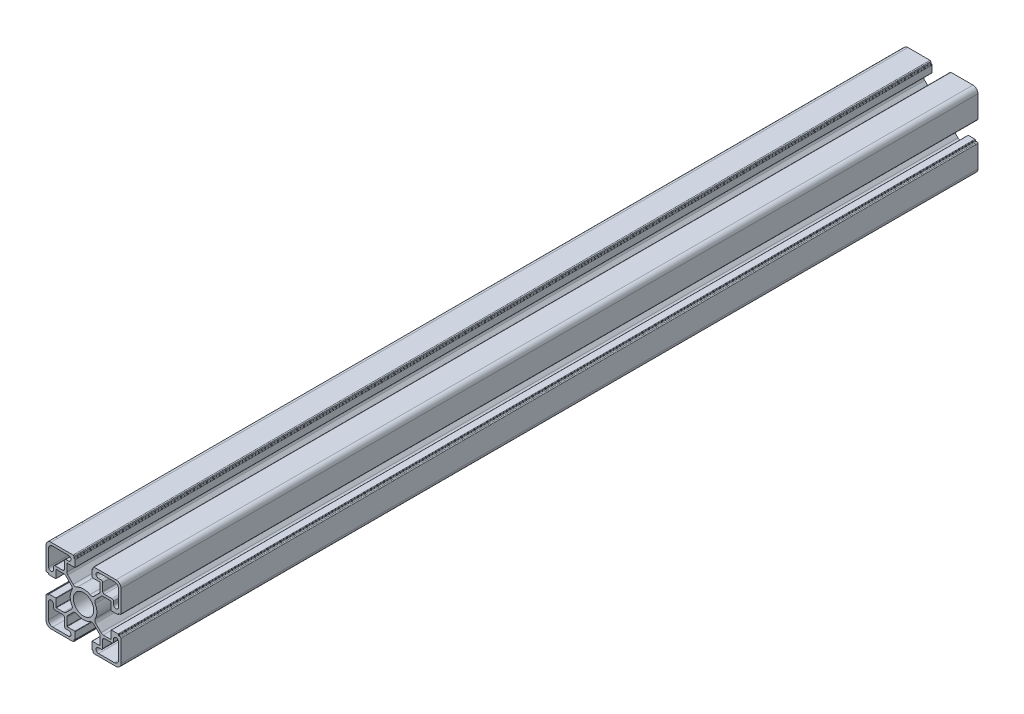
from build123d import *

# Parameters (mm, degrees)
BOSS_EXTRUDE1_DEPTH = 513.777971599
SCALE1_SCALE        = 0.5644444


with BuildPart() as part:
    # Sketch1 → Boss-Extrude1 (new body)
    with BuildSketch(Plane.XY):
        with BuildLine():
            Line((-22.5, 19.5), (-22.5, 6.3))
            ThreePointArc((-22.5, 6.3), (-22.353553391, 5.946446609), (-22, 5.8))
            Line((-22, 5.8), (-21.3, 5.8))
            ThreePointArc((-21.3, 5.8), (-21.087867966, 5.712132034), (-21, 5.5))
            Line((-21, 5.5), (-21, 5.3))
            ThreePointArc((-21, 5.3), (-20.912132034, 5.087867966), (-20.7, 5))
            Line((-20.7, 5), (-16.7, 5))
            ThreePointArc((-16.7, 5), (-16.558578644, 5.058578644), (-16.5, 5.2))
            Line((-16.5, 5.2), (-16.5, 9.8))
            ThreePointArc((-16.5, 9.8), (-16.441421356, 9.941421356), (-16.3, 10))
            Line((-16.3, 10), (-11.864234483, 10))
            ThreePointArc((-11.864234483, 10), (-11.121828624, 9.852326293), (-10.492447327, 9.431787156))
            Line((-10.492447327, 9.431787156), (-7.296699127, 6.236038955))
            ThreePointArc((-7.296699127, 6.236038955), (-6.746669172, 5.129240469), (-6.976648919, 3.914890784))
            ThreePointArc((-6.976648919, 3.914890784), (-7.739935121, 2.023216331), (-8, 0))
            ThreePointArc((-8, 0), (-7.739935121, -2.023216331), (-6.976648919, -3.914890784))
            ThreePointArc((-6.976648919, -3.914890784), (-6.746669172, -5.129240469), (-7.296699127, -6.236038955))
            Line((-7.296699127, -6.236038955), (-10.492447327, -9.431787156))
            ThreePointArc((-10.492447327, -9.431787156), (-11.121828624, -9.852326293), (-11.864234483, -10))
            Line((-11.864234483, -10), (-16.3, -10))
            ThreePointArc((-16.3, -10), (-16.441421356, -9.941421356), (-16.5, -9.8))
            Line((-16.5, -9.8), (-16.5, -5.2))
            ThreePointArc((-16.5, -5.2), (-16.558578644, -5.058578644), (-16.7, -5))
            Line((-16.7, -5), (-20.7, -5))
            ThreePointArc((-20.7, -5), (-20.912132034, -5.087867966), (-21, -5.3))
            Line((-21, -5.3), (-21, -5.5))
            ThreePointArc((-21, -5.5), (-21.087867966, -5.712132034), (-21.3, -5.8))
            Line((-21.3, -5.8), (-22, -5.8))
            ThreePointArc((-22, -5.8), (-22.353553391, -5.946446609), (-22.5, -6.3))
            Line((-22.5, -6.3), (-22.5, -19.5))
            ThreePointArc((-22.5, -19.5), (-21.621320344, -21.621320344), (-19.5, -22.5))
            Line((-19.5, -22.5), (-6.3, -22.5))
            ThreePointArc((-6.3, -22.5), (-5.946446609, -22.353553391), (-5.8, -22))
            Line((-5.8, -22), (-5.8, -21.3))
            ThreePointArc((-5.8, -21.3), (-5.712132034, -21.087867966), (-5.5, -21))
            Line((-5.5, -21), (-5.3, -21))
            ThreePointArc((-5.3, -21), (-5.087867966, -20.912132034), (-5, -20.7))
            Line((-5, -20.7), (-5, -16.7))
            ThreePointArc((-5, -16.7), (-5.058578644, -16.558578644), (-5.2, -16.5))
            Line((-5.2, -16.5), (-9.8, -16.5))
            ThreePointArc((-9.8, -16.5), (-9.941421356, -16.441421356), (-10, -16.3))
            Line((-10, -16.3), (-10, -11.864234483))
            ThreePointArc((-10, -11.864234483), (-9.852326293, -11.121828624), (-9.431787156, -10.492447327))
            Line((-9.431787156, -10.492447327), (-6.236038955, -7.296699127))
            ThreePointArc((-6.236038955, -7.296699127), (-5.129240469, -6.746669172), (-3.914890784, -6.976648919))
            ThreePointArc((-3.914890784, -6.976648919), (-2.023216331, -7.739935121), (0, -8))
            ThreePointArc((0, -8), (2.023216331, -7.739935121), (3.914890784, -6.976648919))
            ThreePointArc((3.914890784, -6.976648919), (5.129240469, -6.746669172), (6.236038955, -7.296699127))
            Line((6.236038955, -7.296699127), (9.431787156, -10.492447327))
            ThreePointArc((9.431787156, -10.492447327), (9.852326293, -11.121828624), (10, -11.864234483))
            Line((10, -11.864234483), (10, -16.3))
            ThreePointArc((10, -16.3), (9.941421356, -16.441421356), (9.8, -16.5))
            Line((9.8, -16.5), (5.2, -16.5))
            ThreePointArc((5.2, -16.5), (5.058578644, -16.558578644), (5, -16.7))
            Line((5, -16.7), (5, -20.7))
            ThreePointArc((5, -20.7), (5.087867966, -20.912132034), (5.3, -21))
            Line((5.3, -21), (5.5, -21))
            ThreePointArc((5.5, -21), (5.712132034, -21.087867966), (5.8, -21.3))
            Line((5.8, -21.3), (5.8, -22))
            ThreePointArc((5.8, -22), (5.946446609, -22.353553391), (6.3, -22.5))
            Line((6.3, -22.5), (19.5, -22.5))
            ThreePointArc((19.5, -22.5), (21.621320344, -21.621320344), (22.5, -19.5))
            Line((22.5, -19.5), (22.5, -6.3))
            ThreePointArc((22.5, -6.3), (22.353553391, -5.946446609), (22, -5.8))
            Line((22, -5.8), (21.3, -5.8))
            ThreePointArc((21.3, -5.8), (21.087867966, -5.712132034), (21, -5.5))
            Line((21, -5.5), (21, -5.3))
            ThreePointArc((21, -5.3), (20.912132034, -5.087867966), (20.7, -5))
            Line((20.7, -5), (16.7, -5))
            ThreePointArc((16.7, -5), (16.558578644, -5.058578644), (16.5, -5.2))
            Line((16.5, -5.2), (16.5, -9.8))
            ThreePointArc((16.5, -9.8), (16.441421356, -9.941421356), (16.3, -10))
            Line((16.3, -10), (11.864234483, -10))
            ThreePointArc((11.864234483, -10), (11.121828624, -9.852326293), (10.492447327, -9.431787156))
            Line((10.492447327, -9.431787156), (7.296699127, -6.236038955))
            ThreePointArc((7.296699127, -6.236038955), (6.746669172, -5.129240469), (6.976648919, -3.914890784))
            ThreePointArc((6.976648919, -3.914890784), (7.739935121, -2.023216331), (8, 0))
            ThreePointArc((8, 0), (7.739935121, 2.023216331), (6.976648919, 3.914890784))
            ThreePointArc((6.976648919, 3.914890784), (6.746669172, 5.129240469), (7.296699127, 6.236038955))
            Line((7.296699127, 6.236038955), (10.492447327, 9.431787156))
            ThreePointArc((10.492447327, 9.431787156), (11.121828624, 9.852326293), (11.864234483, 10))
            Line((11.864234483, 10), (16.3, 10))
            ThreePointArc((16.3, 10), (16.441421356, 9.941421356), (16.5, 9.8))
            Line((16.5, 9.8), (16.5, 5.2))
            ThreePointArc((16.5, 5.2), (16.558578644, 5.058578644), (16.7, 5))
            Line((16.7, 5), (20.7, 5))
            ThreePointArc((20.7, 5), (20.912132034, 5.087867966), (21, 5.3))
            Line((21, 5.3), (21, 5.5))
            ThreePointArc((21, 5.5), (21.087867966, 5.712132034), (21.3, 5.8))
            Line((21.3, 5.8), (22, 5.8))
            ThreePointArc((22, 5.8), (22.353553391, 5.946446609), (22.5, 6.3))
            Line((22.5, 6.3), (22.5, 19.5))
            ThreePointArc((22.5, 19.5), (21.621320344, 21.621320344), (19.5, 22.5))
            Line((19.5, 22.5), (6.3, 22.5))
            ThreePointArc((6.3, 22.5), (5.946446609, 22.353553391), (5.8, 22))
            Line((5.8, 22), (5.8, 21.3))
            ThreePointArc((5.8, 21.3), (5.712132034, 21.087867966), (5.5, 21))
            Line((5.5, 21), (5.3, 21))
            ThreePointArc((5.3, 21), (5.087867966, 20.912132034), (5, 20.7))
            Line((5, 20.7), (5, 16.7))
            ThreePointArc((5, 16.7), (5.058578644, 16.558578644), (5.2, 16.5))
            Line((5.2, 16.5), (9.8, 16.5))
            ThreePointArc((9.8, 16.5), (9.941421356, 16.441421356), (10, 16.3))
            Line((10, 16.3), (10, 11.864234483))
            ThreePointArc((10, 11.864234483), (9.852326293, 11.121828624), (9.431787156, 10.492447327))
            Line((9.431787156, 10.492447327), (6.236038955, 7.296699127))
            ThreePointArc((6.236038955, 7.296699127), (5.129240469, 6.746669172), (3.914890784, 6.976648919))
            ThreePointArc((3.914890784, 6.976648919), (2.023216331, 7.739935121), (0, 8))
            ThreePointArc((0, 8), (-2.023216331, 7.739935121), (-3.914890784, 6.976648919))
            ThreePointArc((-3.914890784, 6.976648919), (-5.129240469, 6.746669172), (-6.236038955, 7.296699127))
            Line((-6.236038955, 7.296699127), (-9.431787156, 10.492447327))
            ThreePointArc((-9.431787156, 10.492447327), (-9.852326293, 11.121828624), (-10, 11.864234483))
            Line((-10, 11.864234483), (-10, 16.3))
            ThreePointArc((-10, 16.3), (-9.941421356, 16.441421356), (-9.8, 16.5))
            Line((-9.8, 16.5), (-5.2, 16.5))
            ThreePointArc((-5.2, 16.5), (-5.058578644, 16.558578644), (-5, 16.7))
            Line((-5, 16.7), (-5, 20.7))
            ThreePointArc((-5, 20.7), (-5.087867966, 20.912132034), (-5.3, 21))
            Line((-5.3, 21), (-5.5, 21))
            ThreePointArc((-5.5, 21), (-5.712132034, 21.087867966), (-5.8, 21.3))
            Line((-5.8, 21.3), (-5.8, 22))
            ThreePointArc((-5.8, 22), (-5.946446609, 22.353553391), (-6.3, 22.5))
            Line((-6.3, 22.5), (-19.5, 22.5))
            ThreePointArc((-19.5, 22.5), (-21.621320344, 21.621320344), (-22.5, 19.5))
        make_face()
        with BuildLine():
            Line((-21, 18.5), (-21, 9))
            ThreePointArc((-21, 9), (-19.5, 7.5), (-18, 9))
            Line((-18, 9), (-18, 10.5))
            ThreePointArc((-18, 10.5), (-17.707106781, 11.207106781), (-17, 11.5))
            Line((-17, 11.5), (-12.5, 11.5))
            ThreePointArc((-12.5, 11.5), (-11.792893219, 11.792893219), (-11.5, 12.5))
            Line((-11.5, 12.5), (-11.5, 17))
            ThreePointArc((-11.5, 17), (-11.207106781, 17.707106781), (-10.5, 18))
            Line((-10.5, 18), (-9, 18))
            ThreePointArc((-9, 18), (-7.5, 19.5), (-9, 21))
            Line((-9, 21), (-18.5, 21))
            ThreePointArc((-18.5, 21), (-20.267766953, 20.267766953), (-21, 18.5))
        make_face(mode=Mode.SUBTRACT)
        with BuildLine():
            Line((18.5, 21), (9, 21))
            ThreePointArc((9, 21), (7.5, 19.5), (9, 18))
            Line((9, 18), (10.5, 18))
            ThreePointArc((10.5, 18), (11.207106781, 17.707106781), (11.5, 17))
            Line((11.5, 17), (11.5, 12.5))
            ThreePointArc((11.5, 12.5), (11.792893219, 11.792893219), (12.5, 11.5))
            Line((12.5, 11.5), (17, 11.5))
            ThreePointArc((17, 11.5), (17.707106781, 11.207106781), (18, 10.5))
            Line((18, 10.5), (18, 9))
            ThreePointArc((18, 9), (19.5, 7.5), (21, 9))
            Line((21, 9), (21, 18.5))
            ThreePointArc((21, 18.5), (20.267766953, 20.267766953), (18.5, 21))
        make_face(mode=Mode.SUBTRACT)
        with BuildLine():
            Line((21, -18.5), (21, -9))
            ThreePointArc((21, -9), (19.5, -7.5), (18, -9))
            Line((18, -9), (18, -10.5))
            ThreePointArc((18, -10.5), (17.707106781, -11.207106781), (17, -11.5))
            Line((17, -11.5), (12.5, -11.5))
            ThreePointArc((12.5, -11.5), (11.792893219, -11.792893219), (11.5, -12.5))
            Line((11.5, -12.5), (11.5, -17))
            ThreePointArc((11.5, -17), (11.207106781, -17.707106781), (10.5, -18))
            Line((10.5, -18), (9, -18))
            ThreePointArc((9, -18), (7.5, -19.5), (9, -21))
            Line((9, -21), (18.5, -21))
            ThreePointArc((18.5, -21), (20.267766953, -20.267766953), (21, -18.5))
        make_face(mode=Mode.SUBTRACT)
        with BuildLine():
            Line((-18.5, -21), (-9, -21))
            ThreePointArc((-9, -21), (-7.5, -19.5), (-9, -18))
            Line((-9, -18), (-10.5, -18))
            ThreePointArc((-10.5, -18), (-11.207106781, -17.707106781), (-11.5, -17))
            Line((-11.5, -17), (-11.5, -12.5))
            ThreePointArc((-11.5, -12.5), (-11.792893219, -11.792893219), (-12.5, -11.5))
            Line((-12.5, -11.5), (-17, -11.5))
            ThreePointArc((-17, -11.5), (-17.707106781, -11.207106781), (-18, -10.5))
            Line((-18, -10.5), (-18, -9))
            ThreePointArc((-18, -9), (-19.5, -7.5), (-21, -9))
            Line((-21, -9), (-21, -18.5))
            ThreePointArc((-21, -18.5), (-20.267766953, -20.267766953), (-18.5, -21))
        make_face(mode=Mode.SUBTRACT)
        with BuildLine():
            ThreePointArc((0, 6.1), (-4.313351365, 4.313351365), (-6.1, 0))
            ThreePointArc((-6.1, 0), (-4.313351365, -4.313351365), (0, -6.1))
            ThreePointArc((0, -6.1), (4.313351365, -4.313351365), (6.1, 0))
            ThreePointArc((6.1, 0), (4.313351365, 4.313351365), (0, 6.1))
        make_face(mode=Mode.SUBTRACT)
    extrude(amount=BOSS_EXTRUDE1_DEPTH)


with BuildPart() as part_1:
    # Scale1: scaled about (0, 0, 256.8889858)
    add(part.part.scale(SCALE1_SCALE).moved(Location((0, 0, 111.889436344))))


solid = part_1.part
